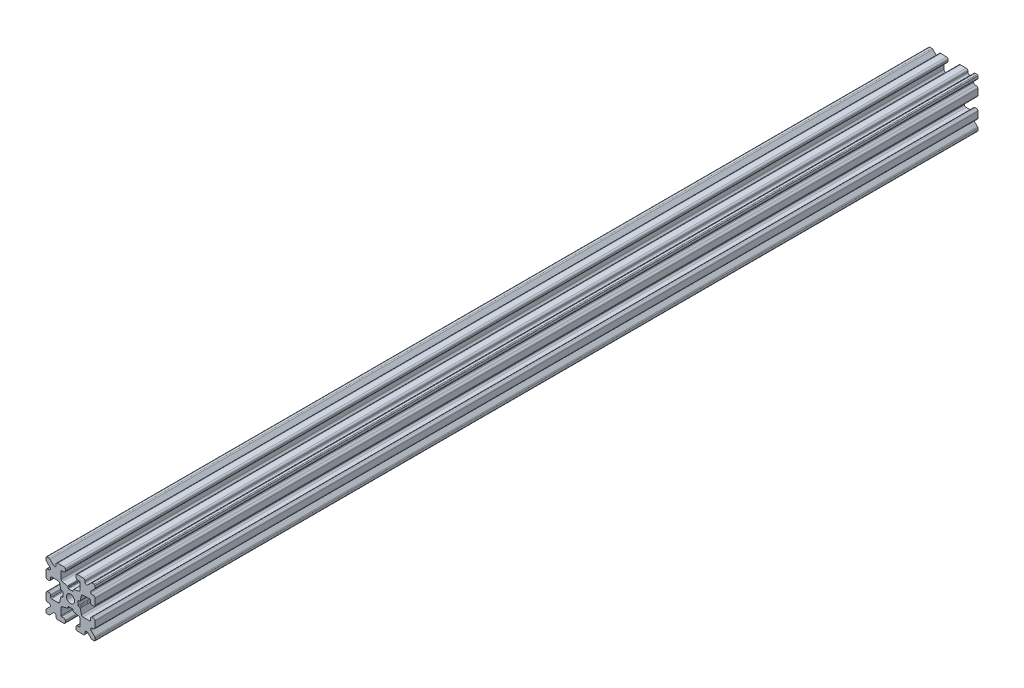
from build123d import *

# Parameters (mm, degrees)
SKETCH1_R           = 1.25
BOSS_EXTRUDE1_DEPTH = 270


with BuildPart() as part:
    # Sketch1 → Boss-Extrude1 (new body)
    with BuildSketch(Plane(origin=(0, 0, -105), x_dir=(-1, 0, 0), z_dir=(0, 0, -1))):
        with BuildLine():
            Line((0.8255, 2.774891226), (0.8255, 2.5470646))
            ThreePointArc((0.8255, 2.5470646), (0.766921356, 2.405643244), (0.6255, 2.3470646))
            Line((0.6255, 2.3470646), (-0.6255, 2.3470646))
            ThreePointArc((-0.6255, 2.3470646), (-0.766921356, 2.405643244), (-0.8255, 2.5470646))
            Line((-0.8255, 2.5470646), (-0.8255, 2.774891226))
            ThreePointArc((-0.8255, 2.774891226), (-0.869377519, 2.89989431), (-0.981757709, 2.970049142))
            Line((-0.981757709, 2.970049142), (-2.509355728, 3.312441801))
            ThreePointArc((-2.509355728, 3.312441801), (-2.790306203, 3.487828881), (-2.9, 3.80033659))
            Line((-2.9, 3.80033659), (-2.9, 5.9))
            ThreePointArc((-2.9, 5.9), (-2.841421356, 6.041421356), (-2.7, 6.1))
            Line((-2.7, 6.1), (-2.1, 6.1))
            ThreePointArc((-2.1, 6.1), (-1.746446609, 6.246446609), (-1.6, 6.6))
            Line((-1.6, 6.6), (-1.6, 7))
            ThreePointArc((-1.6, 7), (-1.746446609, 7.353553391), (-2.1, 7.5))
            Line((-2.1, 7.5), (-3.9, 7.5))
            ThreePointArc((-3.9, 7.5), (-4.253553391, 7.353553391), (-4.4, 7))
            Line((-4.4, 7), (-4.4, 6.667766953))
            ThreePointArc((-4.4, 6.667766953), (-4.708658284, 6.205827187), (-5.253553391, 6.314213562))
            Line((-5.253553391, 6.314213562), (-6.292893219, 7.353553391))
            ThreePointArc((-6.292893219, 7.353553391), (-6.455104893, 7.461939766), (-6.646446609, 7.5))
            Line((-6.646446609, 7.5), (-7.25, 7.5))
            ThreePointArc((-7.25, 7.5), (-7.426776695, 7.426776695), (-7.5, 7.25))
            Line((-7.5, 7.25), (-7.5, 6.646446609))
            ThreePointArc((-7.5, 6.646446609), (-7.461939766, 6.455104893), (-7.353553391, 6.292893219))
            Line((-7.353553391, 6.292893219), (-6.314213562, 5.253553391))
            ThreePointArc((-6.314213562, 5.253553391), (-6.205827187, 4.708658284), (-6.667766953, 4.4))
            Line((-6.667766953, 4.4), (-7, 4.4))
            ThreePointArc((-7, 4.4), (-7.353553391, 4.253553391), (-7.5, 3.9))
            Line((-7.5, 3.9), (-7.5, 2.1))
            ThreePointArc((-7.5, 2.1), (-7.353553391, 1.746446609), (-7, 1.6))
            Line((-7, 1.6), (-6.6, 1.6))
            ThreePointArc((-6.6, 1.6), (-6.246446609, 1.746446609), (-6.1, 2.1))
            Line((-6.1, 2.1), (-6.1, 2.7))
            ThreePointArc((-6.1, 2.7), (-6.041421356, 2.841421356), (-5.9, 2.9))
            Line((-5.9, 2.9), (-3.80033659, 2.9))
            ThreePointArc((-3.80033659, 2.9), (-3.487828881, 2.790306203), (-3.312441801, 2.509355728))
            Line((-3.312441801, 2.509355728), (-2.970049142, 0.981757709))
            ThreePointArc((-2.970049142, 0.981757709), (-2.89989431, 0.869377519), (-2.774891226, 0.8255))
            Line((-2.774891226, 0.8255), (-2.5470646, 0.8255))
            ThreePointArc((-2.5470646, 0.8255), (-2.405643244, 0.766921356), (-2.3470646, 0.6255))
            Line((-2.3470646, 0.6255), (-2.3470646, -0.6255))
            ThreePointArc((-2.3470646, -0.6255), (-2.405643244, -0.766921356), (-2.5470646, -0.8255))
            Line((-2.5470646, -0.8255), (-2.774891226, -0.8255))
            ThreePointArc((-2.774891226, -0.8255), (-2.89989431, -0.869377519), (-2.970049142, -0.981757709))
            Line((-2.970049142, -0.981757709), (-3.312441801, -2.509355728))
            ThreePointArc((-3.312441801, -2.509355728), (-3.487828881, -2.790306203), (-3.80033659, -2.9))
            Line((-3.80033659, -2.9), (-5.9, -2.9))
            ThreePointArc((-5.9, -2.9), (-6.041421356, -2.841421356), (-6.1, -2.7))
            Line((-6.1, -2.7), (-6.1, -2.1))
            ThreePointArc((-6.1, -2.1), (-6.246446609, -1.746446609), (-6.6, -1.6))
            Line((-6.6, -1.6), (-7, -1.6))
            ThreePointArc((-7, -1.6), (-7.353553391, -1.746446609), (-7.5, -2.1))
            Line((-7.5, -2.1), (-7.5, -3.9))
            ThreePointArc((-7.5, -3.9), (-7.353553391, -4.253553391), (-7, -4.4))
            Line((-7, -4.4), (-6.667766953, -4.4))
            ThreePointArc((-6.667766953, -4.4), (-6.205827187, -4.708658284), (-6.314213562, -5.253553391))
            Line((-6.314213562, -5.253553391), (-7.353553391, -6.292893219))
            ThreePointArc((-7.353553391, -6.292893219), (-7.461939766, -6.455104893), (-7.5, -6.646446609))
            Line((-7.5, -6.646446609), (-7.5, -7.25))
            ThreePointArc((-7.5, -7.25), (-7.426776695, -7.426776695), (-7.25, -7.5))
            Line((-7.25, -7.5), (-6.646446609, -7.5))
            ThreePointArc((-6.646446609, -7.5), (-6.455104893, -7.461939766), (-6.292893219, -7.353553391))
            Line((-6.292893219, -7.353553391), (-5.253553391, -6.314213562))
            ThreePointArc((-5.253553391, -6.314213562), (-4.708658284, -6.205827187), (-4.4, -6.667766953))
            Line((-4.4, -6.667766953), (-4.4, -7))
            ThreePointArc((-4.4, -7), (-4.253553391, -7.353553391), (-3.9, -7.5))
            Line((-3.9, -7.5), (-2.1, -7.5))
            ThreePointArc((-2.1, -7.5), (-1.746446609, -7.353553391), (-1.6, -7))
            Line((-1.6, -7), (-1.6, -6.6))
            ThreePointArc((-1.6, -6.6), (-1.746446609, -6.246446609), (-2.1, -6.1))
            Line((-2.1, -6.1), (-2.7, -6.1))
            ThreePointArc((-2.7, -6.1), (-2.841421356, -6.041421356), (-2.9, -5.9))
            Line((-2.9, -5.9), (-2.9, -3.80033659))
            ThreePointArc((-2.9, -3.80033659), (-2.790306203, -3.487828881), (-2.509355728, -3.312441801))
            Line((-2.509355728, -3.312441801), (-0.981757709, -2.970049142))
            ThreePointArc((-0.981757709, -2.970049142), (-0.869377519, -2.89989431), (-0.8255, -2.774891226))
            Line((-0.8255, -2.774891226), (-0.8255, -2.5470646))
            ThreePointArc((-0.8255, -2.5470646), (-0.766921356, -2.405643244), (-0.6255, -2.3470646))
            Line((-0.6255, -2.3470646), (0.6255, -2.3470646))
            ThreePointArc((0.6255, -2.3470646), (0.766921356, -2.405643244), (0.8255, -2.5470646))
            Line((0.8255, -2.5470646), (0.8255, -2.774891226))
            ThreePointArc((0.8255, -2.774891226), (0.869377519, -2.89989431), (0.981757709, -2.970049142))
            Line((0.981757709, -2.970049142), (2.509355728, -3.312441801))
            ThreePointArc((2.509355728, -3.312441801), (2.790306203, -3.487828881), (2.9, -3.80033659))
            Line((2.9, -3.80033659), (2.9, -5.9))
            ThreePointArc((2.9, -5.9), (2.841421356, -6.041421356), (2.7, -6.1))
            Line((2.7, -6.1), (2.1, -6.1))
            ThreePointArc((2.1, -6.1), (1.746446609, -6.246446609), (1.6, -6.6))
            Line((1.6, -6.6), (1.6, -7))
            ThreePointArc((1.6, -7), (1.746446609, -7.353553391), (2.1, -7.5))
            Line((2.1, -7.5), (3.9, -7.5))
            ThreePointArc((3.9, -7.5), (4.253553391, -7.353553391), (4.4, -7))
            Line((4.4, -7), (4.4, -6.667766953))
            ThreePointArc((4.4, -6.667766953), (4.708658284, -6.205827187), (5.253553391, -6.314213562))
            Line((5.253553391, -6.314213562), (6.292893219, -7.353553391))
            ThreePointArc((6.292893219, -7.353553391), (6.455104893, -7.461939766), (6.646446609, -7.5))
            Line((6.646446609, -7.5), (7.25, -7.5))
            ThreePointArc((7.25, -7.5), (7.426776695, -7.426776695), (7.5, -7.25))
            Line((7.5, -7.25), (7.5, -6.646446609))
            ThreePointArc((7.5, -6.646446609), (7.461939766, -6.455104893), (7.353553391, -6.292893219))
            Line((7.353553391, -6.292893219), (6.314213562, -5.253553391))
            ThreePointArc((6.314213562, -5.253553391), (6.205827187, -4.708658284), (6.667766953, -4.4))
            Line((6.667766953, -4.4), (7, -4.4))
            ThreePointArc((7, -4.4), (7.353553391, -4.253553391), (7.5, -3.9))
            Line((7.5, -3.9), (7.5, -2.1))
            ThreePointArc((7.5, -2.1), (7.353553391, -1.746446609), (7, -1.6))
            Line((7, -1.6), (6.6, -1.6))
            ThreePointArc((6.6, -1.6), (6.246446609, -1.746446609), (6.1, -2.1))
            Line((6.1, -2.1), (6.1, -2.7))
            ThreePointArc((6.1, -2.7), (6.041421356, -2.841421356), (5.9, -2.9))
            Line((5.9, -2.9), (3.80033659, -2.9))
            ThreePointArc((3.80033659, -2.9), (3.487828881, -2.790306203), (3.312441801, -2.509355728))
            Line((3.312441801, -2.509355728), (2.970049142, -0.981757709))
            ThreePointArc((2.970049142, -0.981757709), (2.89989431, -0.869377519), (2.774891226, -0.8255))
            Line((2.774891226, -0.8255), (2.5470646, -0.8255))
            ThreePointArc((2.5470646, -0.8255), (2.405643244, -0.766921356), (2.3470646, -0.6255))
            Line((2.3470646, -0.6255), (2.3470646, 0.6255))
            ThreePointArc((2.3470646, 0.6255), (2.405643244, 0.766921356), (2.5470646, 0.8255))
            Line((2.5470646, 0.8255), (2.774891226, 0.8255))
            ThreePointArc((2.774891226, 0.8255), (2.89989431, 0.869377519), (2.970049142, 0.981757709))
            Line((2.970049142, 0.981757709), (3.312441801, 2.509355728))
            ThreePointArc((3.312441801, 2.509355728), (3.487828881, 2.790306203), (3.80033659, 2.9))
            Line((3.80033659, 2.9), (5.9, 2.9))
            ThreePointArc((5.9, 2.9), (6.041421356, 2.841421356), (6.1, 2.7))
            Line((6.1, 2.7), (6.1, 2.1))
            ThreePointArc((6.1, 2.1), (6.246446609, 1.746446609), (6.6, 1.6))
            Line((6.6, 1.6), (7, 1.6))
            ThreePointArc((7, 1.6), (7.353553391, 1.746446609), (7.5, 2.1))
            Line((7.5, 2.1), (7.5, 3.9))
            ThreePointArc((7.5, 3.9), (7.353553391, 4.253553391), (7, 4.4))
            Line((7, 4.4), (6.667766953, 4.4))
            ThreePointArc((6.667766953, 4.4), (6.205827187, 4.708658284), (6.314213562, 5.253553391))
            Line((6.314213562, 5.253553391), (7.353553391, 6.292893219))
            ThreePointArc((7.353553391, 6.292893219), (7.461939766, 6.455104893), (7.5, 6.646446609))
            Line((7.5, 6.646446609), (7.5, 7.25))
            ThreePointArc((7.5, 7.25), (7.426776695, 7.426776695), (7.25, 7.5))
            Line((7.25, 7.5), (6.646446609, 7.5))
            ThreePointArc((6.646446609, 7.5), (6.455104893, 7.461939766), (6.292893219, 7.353553391))
            Line((6.292893219, 7.353553391), (5.253553391, 6.314213562))
            ThreePointArc((5.253553391, 6.314213562), (4.708658284, 6.205827187), (4.4, 6.667766953))
            Line((4.4, 6.667766953), (4.4, 7))
            ThreePointArc((4.4, 7), (4.253553391, 7.353553391), (3.9, 7.5))
            Line((3.9, 7.5), (2.1, 7.5))
            ThreePointArc((2.1, 7.5), (1.746446609, 7.353553391), (1.6, 7))
            Line((1.6, 7), (1.6, 6.6))
            ThreePointArc((1.6, 6.6), (1.746446609, 6.246446609), (2.1, 6.1))
            Line((2.1, 6.1), (2.7, 6.1))
            ThreePointArc((2.7, 6.1), (2.841421356, 6.041421356), (2.9, 5.9))
            Line((2.9, 5.9), (2.9, 3.80033659))
            ThreePointArc((2.9, 3.80033659), (2.790306203, 3.487828881), (2.509355728, 3.312441801))
            Line((2.509355728, 3.312441801), (0.981757709, 2.970049142))
            ThreePointArc((0.981757709, 2.970049142), (0.869377519, 2.89989431), (0.8255, 2.774891226))
        make_face()
        with Locations(Location((0, 0, 0), (0, 0, 180))):
            Circle(SKETCH1_R, mode=Mode.SUBTRACT)
    extrude(amount=-BOSS_EXTRUDE1_DEPTH)


solid = part.part
